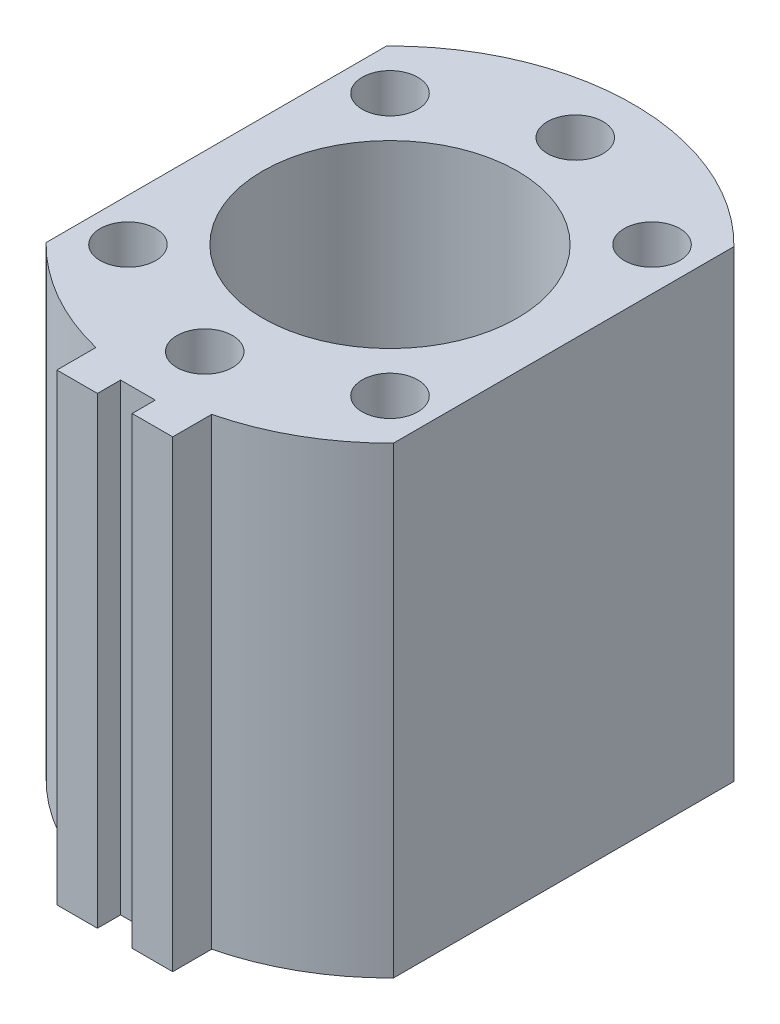
from build123d import *

# Parameters (mm, degrees)
EXTRUDE_1_DEPTH          = 40
SKETCH_2_R               = 11
CUT_EXTRUDE_1_DEPTH      = 48.602520942
SKETCH_3_R               = 2.4
CUT_EXTRUDE_2_DEPTH      = 8
PATTERN_CIRCULAR_2_COUNT = 8
SKETCH_4_W               = 10
SKETCH_4_H               = 3.367948213
EXTRUDE_2_DEPTH          = 40
SKETCH_5_W               = 3
SKETCH_5_H               = 2
CUT_EXTRUDE_3_DEPTH      = 49.884853937


with BuildPart() as part:
    # 草图1 → 凸台-拉伸1 (new body)
    with BuildSketch(Plane(origin=(0, 0, 0), x_dir=(1, 0, 0), z_dir=(0, 1, 0))):
        with BuildLine():
            Line((-15, 14.696938457), (-15, -14.696938457))
            ThreePointArc((-15, -14.696938457), (0, -21), (15, -14.696938457))
            Line((15, -14.696938457), (15, 14.696938457))
            ThreePointArc((15, 14.696938457), (0, 21), (-15, 14.696938457))
        make_face()
    extrude(amount=EXTRUDE_1_DEPTH)

    # 草图2 → 切除-拉伸1 (cut, through all)
    with BuildSketch(Plane(origin=(0, 40, 0), x_dir=(1, 0, 0), z_dir=(0, 1, 0))):
        with Locations(Location((0, 0, 0), (0, 0, 270))):
            Circle(SKETCH_2_R)
    extrude(amount=-CUT_EXTRUDE_1_DEPTH, mode=Mode.SUBTRACT)

    # 草图3 → 切除-拉伸2 (cut)
    with BuildSketch(Plane(origin=(0, 40, 0), x_dir=(1, 0, 0), z_dir=(0, 1, 0))):
        with Locations(Location((-11.313708499, 11.313708499, 0), (0, 0, 270))):
            Circle(SKETCH_3_R)
    cut_extrude_2 = extrude(amount=-CUT_EXTRUDE_2_DEPTH, mode=Mode.SUBTRACT)

    # 阵列(圆周)2: 切除-拉伸2 ×8 about axis, 2 skipped
    pattern_circular_2_axis = Axis((0, 40, 0), (0, 1, 0))
    add([cut_extrude_2.rotate(pattern_circular_2_axis, i * 360 / PATTERN_CIRCULAR_2_COUNT) for i in range(1, PATTERN_CIRCULAR_2_COUNT) if i not in (1, 5)], mode=Mode.SUBTRACT)

    # 草图4 → 凸台-拉伸2 (add)
    with BuildSketch(Plane(origin=(0, 0, 0), x_dir=(1, 0, 0), z_dir=(0, 1, 0))):
        with Locations((0, -22.080052161)):
            Rectangle(SKETCH_4_W, SKETCH_4_H)
    extrude(amount=EXTRUDE_2_DEPTH)

    # 草图5 → 切除-拉伸3 (cut, through all)
    with BuildSketch(Plane(origin=(0, 0, 0), x_dir=(1, 0, 0), z_dir=(0, 1, 0))):
        with Locations((0, -22.764026267)):
            Rectangle(SKETCH_5_W, SKETCH_5_H)
    extrude(amount=CUT_EXTRUDE_3_DEPTH, mode=Mode.SUBTRACT)


solid = part.part
